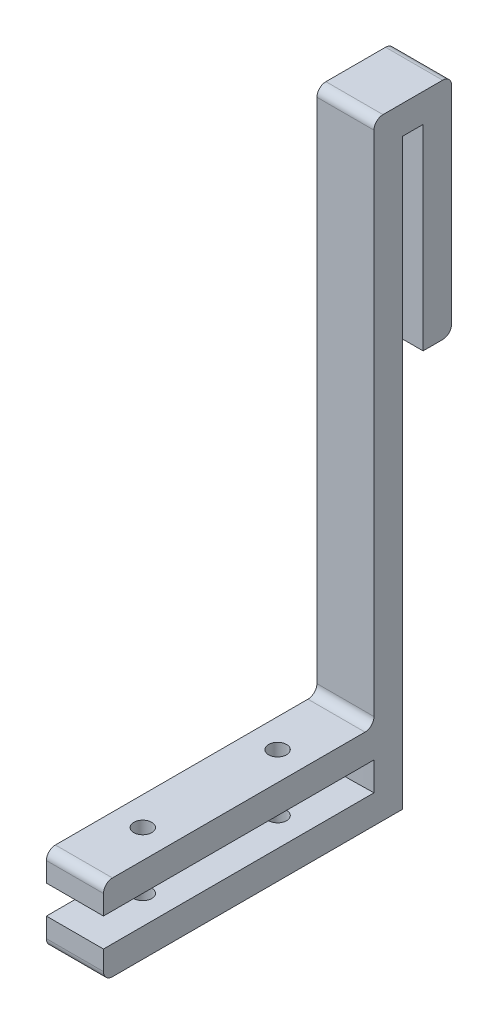
from build123d import *

# Parameters (mm, degrees)
SKETCH1_W           = 12.7
SKETCH1_H           = 66.548
BOSS_EXTRUDE1_DEPTH = 6.35
SKETCH2_W           = 12.7
SKETCH2_H           = 6.35
BOSS_EXTRUDE2_DEPTH = 6.35
SKETCH3_W           = 12.7
SKETCH3_H           = 66.548
BOSS_EXTRUDE3_DEPTH = 6.35
SKETCH4_W           = 12.7
SKETCH4_H           = 6.35
BOSS_EXTRUDE4_DEPTH = 117
SKETCH5_W           = 12.7
SKETCH5_H           = 6.35
BOSS_EXTRUDE5_DEPTH = 4.572
SKETCH6_W           = 12.7
SKETCH6_H           = 50
BOSS_EXTRUDE6_DEPTH = 6.35
BOSS_EXTRUDE7_DEPTH = 6.35
SKETCH9_R           = 2
CUT_EXTRUDE1_DEPTH  = 141.896738429
FILLET1_R           = 2
FILLET2_R           = 2


with BuildPart() as part:
    # Sketch1 → Boss-Extrude1 (new body)
    with BuildSketch(Plane(origin=(0, 0, 0), x_dir=(1, 0, 0), z_dir=(0, 1, 0))):
        with Locations((6.35, 33.274)):
            Rectangle(SKETCH1_W, SKETCH1_H)
    extrude(amount=BOSS_EXTRUDE1_DEPTH)

    # Sketch2 → Boss-Extrude2 (add)
    with BuildSketch(Plane(origin=(0, 6.35, 0), x_dir=(1, 0, 0), z_dir=(0, 1, 0))):
        with Locations((6.35, 63.373)):
            Rectangle(SKETCH2_W, SKETCH2_H)
    extrude(amount=BOSS_EXTRUDE2_DEPTH)

    # Sketch3 → Boss-Extrude3 (add)
    with BuildSketch(Plane(origin=(0, 12.7, 0), x_dir=(1, 0, 0), z_dir=(0, 1, 0))):
        with Locations((6.35, 33.274)):
            Rectangle(SKETCH3_W, SKETCH3_H)
    extrude(amount=BOSS_EXTRUDE3_DEPTH)

    # Sketch4 → Boss-Extrude4 (add)
    with BuildSketch(Plane(origin=(0, 19.05, 0), x_dir=(1, 0, 0), z_dir=(0, 1, 0))):
        with Locations((6.35, 63.373)):
            Rectangle(SKETCH4_W, SKETCH4_H)
    extrude(amount=BOSS_EXTRUDE4_DEPTH)

    # Sketch5 → Boss-Extrude5 (add)
    with BuildSketch(Plane(origin=(0, 0, -66.548), x_dir=(-1, 0, 0), z_dir=(0, 0, -1))):
        with Locations((-6.35, 132.875)):
            Rectangle(SKETCH5_W, SKETCH5_H)
    extrude(amount=BOSS_EXTRUDE5_DEPTH)

    # Sketch6 → Boss-Extrude6 (add)
    with BuildSketch(Plane(origin=(0, 0, -71.12), x_dir=(-1, 0, 0), z_dir=(0, 0, -1))):
        with Locations((-6.35, 111.05)):
            Rectangle(SKETCH6_W, SKETCH6_H)
    extrude(amount=BOSS_EXTRUDE6_DEPTH)

    # Sketch7 → Boss-Extrude7 (add)
    with BuildSketch(Plane(origin=(0, 6.35, 0), x_dir=(1, 0, 0), z_dir=(0, 1, 0))):
        with BuildLine():
            Line((12.7, 60.198), (0, 60.198))
            ThreePointArc((0, 60.198), (6.35, 60.107267194), (12.7, 60.198))
        make_face()
    extrude(amount=BOSS_EXTRUDE7_DEPTH)

    # Sketch9 → Cut-Extrude1 (cut, through all)
    with BuildSketch(Plane(origin=(0, 19.05, 0), x_dir=(1, 0, 0), z_dir=(0, 1, 0))):
        with Locations(Location((6.35, 45.099, 0), (0, 0, 270))):
            Circle(SKETCH9_R)
        with Locations(Location((6.35, 15.099, 0), (0, 0, 270))):
            Circle(SKETCH9_R)
    extrude(amount=-CUT_EXTRUDE1_DEPTH, mode=Mode.SUBTRACT)

    # Fillet1
    fillet1_edges = [part.edges().sort_by_distance(p)[0] for p in [
        (6.35, 19.05, 0),
        (6.35, 136.05, -60.198),
        (6.35, 0, 0),
        (6.35, 86.05, -77.47),
        (6.35, 136.05, -77.47),
    ]]
    fillet(fillet1_edges, radius=FILLET1_R)

    # Fillet2
    fillet2_edges = [part.edges().sort_by_distance(p)[0] for p in [
        (6.35, 19.05, -60.198),
    ]]
    fillet(fillet2_edges, radius=FILLET2_R)


solid = part.part
